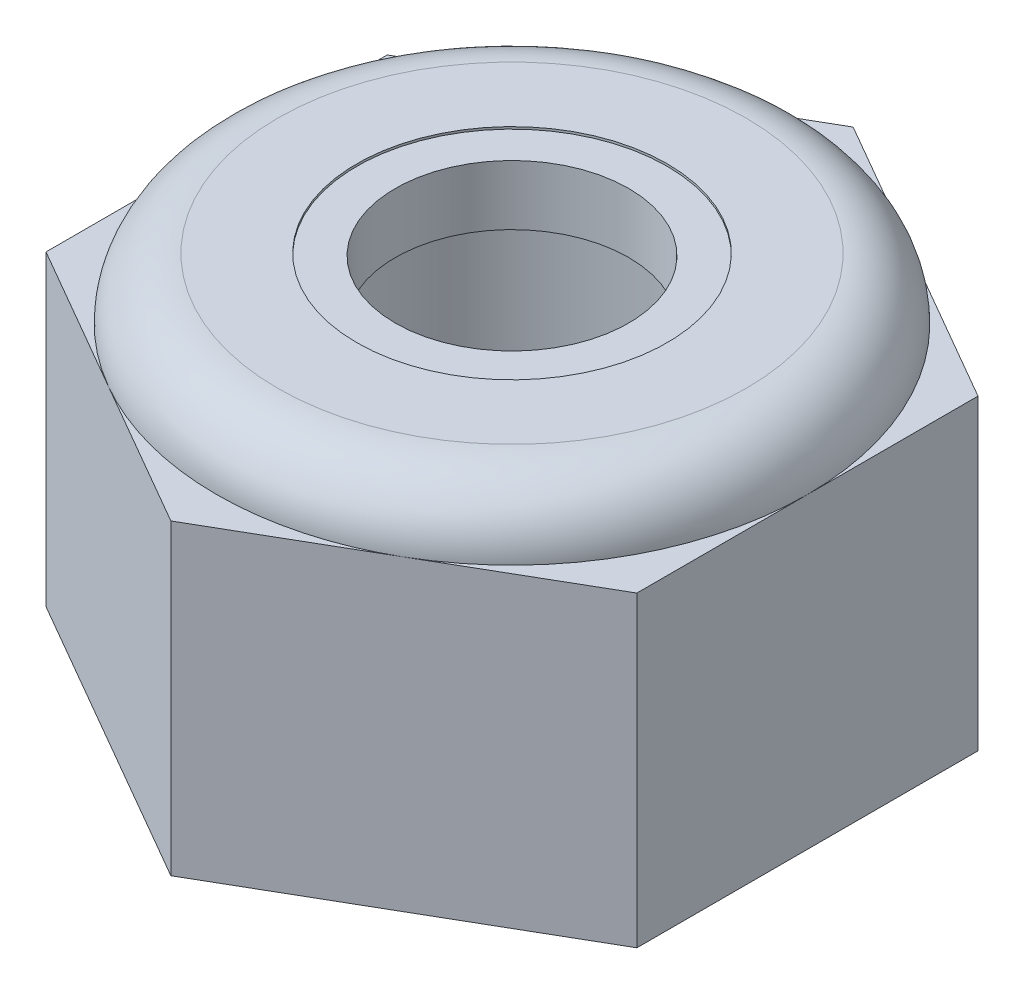
from build123d import *

# Parameters (mm, degrees)
BOSS_EXTRUDE1_DEPTH         = 4.159999906
TAP_DRILL_FOR_M5X0_8_TAP1_D = 4.2
SKETCH8_W                   = 0.52
SKETCH8_H                   = 0.81


with BuildPart() as part:
    # Sketch1 → Boss-Extrude1 (new body)
    with BuildSketch(Plane(origin=(0, 0, 0), x_dir=(1, 0, 0), z_dir=(0, 1, 0))):
        Polygon((-4, -2.309401077), (0, -4.618802154), (4, -2.309401077), (4, 2.309401077), (0, 4.618802154), (-4, 2.309401077), align=None)
    extrude(amount=BOSS_EXTRUDE1_DEPTH)

    # Sketch3 → Revolve1 (revolve)
    with BuildSketch(Plane.XY, mode=Mode.PRIVATE) as revolve1_sk:
        with BuildLine():
            Line((3.17, 4.989999906), (0, 4.989999906))
            Line((0, 4.989999906), (0, 4.159999906))
            Line((0, 4.159999906), (4, 4.159999906))
            ThreePointArc((4, 4.159999906), (3.756898628, 4.746898534), (3.17, 4.989999906))
        make_face()
    revolve(revolve1_sk.sketch.rotate(Axis((0, 4.989999906, 0), (0, -1, 0)), 90), axis=Axis((0, 4.989999906, 0), (0, -1, 0)))

    # Tap Drill for M5x0.8 Tap1 (through all)
    with Locations(Plane(origin=(0, 0, 0), x_dir=(-1, 0, 0), z_dir=(0, -1, 0))):
        with Locations((0, 0)):
            Hole(TAP_DRILL_FOR_M5X0_8_TAP1_D / 2)

    # Sketch8 → Revolve2 (revolve)
    with BuildSketch(Plane.XY, mode=Mode.PRIVATE) as revolve2_sk:
        with Locations((1.84, 4.554999966)):
            Rectangle(SKETCH8_W, SKETCH8_H)
    revolve(revolve2_sk.sketch.rotate(Axis((0, 4.989999906, 0), (0, -1, 0)), 270), axis=Axis((0, 4.989999906, 0), (0, -1, 0)))


solid = part.part
